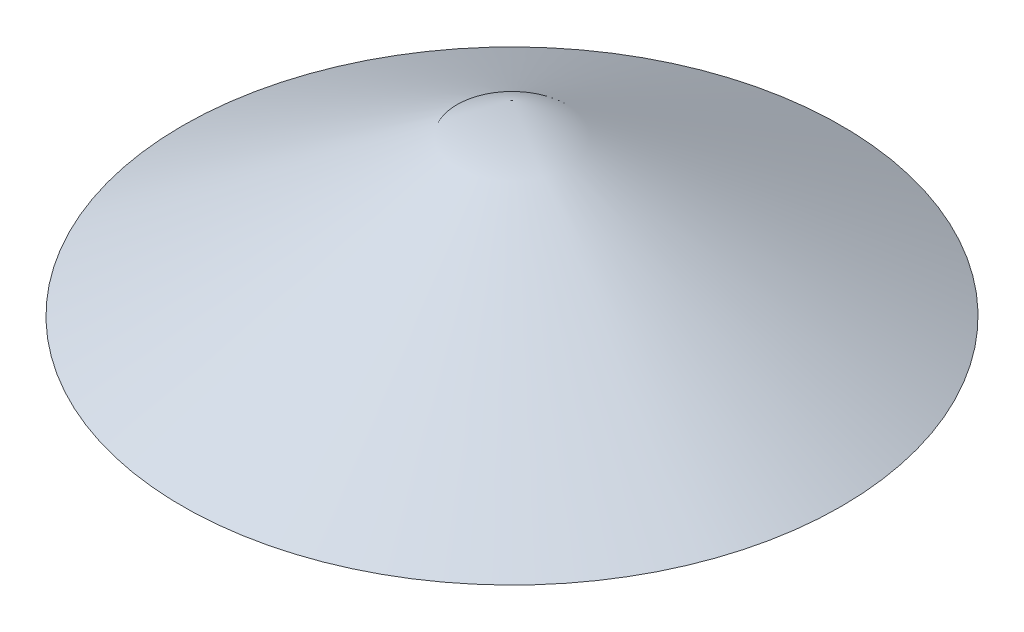
from build123d import *


with BuildPart() as part:
    # Sketch1 → Revolve1 (revolve)
    with BuildSketch(Plane.XY):
        Polygon((0, 0), (30, 0), (0, 17), align=None)
    revolve(axis=Axis((0, 17, 0), (0, -1, 0)))


solid = part.part
